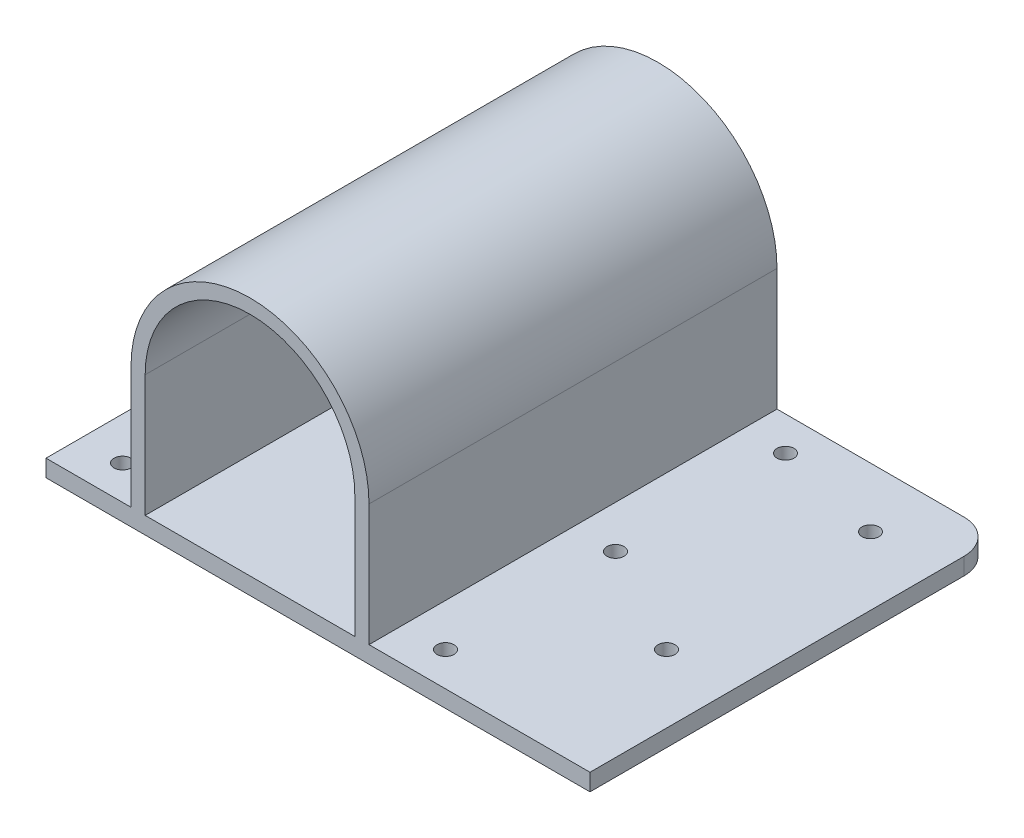
from build123d import *

# Parameters (mm, degrees)
SKETCH1_R           = 1.65
SKETCH1_R_2         = 6.15
BOSS_EXTRUDE1_DEPTH = 72
CUT_EXTRUDE1_DEPTH  = 57
SKETCH3_R           = 1.5
CUT_EXTRUDE2_DEPTH  = 92.028841583
SKETCH4_W           = 24
SKETCH4_H           = 72
SKETCH4_R           = 1.5
BOSS_EXTRUDE2_DEPTH = 3
FILLET1_R           = 6


with BuildPart() as part:
    # Sketch1 → Boss-Extrude1 (new body)
    with BuildSketch(Plane.XY):
        with BuildLine():
            Line((-21, 0), (-21, -21.5))
            Line((-21, -21.5), (-36, -21.5))
            Line((-36, -21.5), (-36, -24.5))
            Line((-36, -24.5), (36, -24.5))
            Line((36, -24.5), (36, -21.5))
            Line((36, -21.5), (21, -21.5))
            Line((21, -21.5), (21, 0))
            ThreePointArc((21, 0), (0, 21), (-21, 0))
        make_face()
        with Locations((0, 15.5)):
            Circle(SKETCH1_R, mode=Mode.SUBTRACT)
        with Locations((13.423393759, 7.75)):
            Circle(SKETCH1_R, mode=Mode.SUBTRACT)
        with Locations((13.423393759, -7.75)):
            Circle(SKETCH1_R, mode=Mode.SUBTRACT)
        with Locations((0, -15.5)):
            Circle(SKETCH1_R, mode=Mode.SUBTRACT)
        with Locations((-13.423393759, -7.75)):
            Circle(SKETCH1_R, mode=Mode.SUBTRACT)
        with Locations((-13.423393759, 7.75)):
            Circle(SKETCH1_R, mode=Mode.SUBTRACT)
        with Locations((7, 0)):
            Circle(SKETCH1_R_2, mode=Mode.SUBTRACT)
    extrude(amount=BOSS_EXTRUDE1_DEPTH)

    # Sketch2 → Cut-Extrude1 (cut)
    with BuildSketch(Plane.XY.offset(72)):
        with BuildLine():
            Line((-18.5, 0), (-18.5, -21.5))
            Line((-18.5, -21.5), (18.5, -21.5))
            Line((18.5, -21.5), (18.5, 0))
            ThreePointArc((18.5, 0), (0, 18.5), (-18.5, 0))
        make_face()
    extrude(amount=-CUT_EXTRUDE1_DEPTH, mode=Mode.SUBTRACT)

    # Sketch3 → Cut-Extrude2 (cut, through all)
    with BuildSketch(Plane(origin=(0, -21.5, 0), x_dir=(1, 0, 0), z_dir=(0, 1, 0))):
        with Locations(Location((-28.5, -36, 0), (0, 0, 270))):
            Circle(SKETCH3_R)
        with Locations(Location((-28.5, -6, 0), (0, 0, 270))):
            Circle(SKETCH3_R)
        with Locations(Location((-28.5, -66, 0), (0, 0, 270))):
            Circle(SKETCH3_R)
        with Locations(Location((28.5, -66, 0), (0, 0, 90))):
            Circle(SKETCH3_R)
        with Locations(Location((28.5, -6, 0), (0, 0, 90))):
            Circle(SKETCH3_R)
        with Locations(Location((28.5, -36, 0), (0, 0, 90))):
            Circle(SKETCH3_R)
    extrude(amount=-CUT_EXTRUDE2_DEPTH, mode=Mode.SUBTRACT)

    # Sketch4 → Boss-Extrude2 (add)
    with BuildSketch(Plane(origin=(0, -21.5, 0), x_dir=(1, 0, 0), z_dir=(0, 1, 0))):
        with Locations((48, -36)):
            Rectangle(SKETCH4_W, SKETCH4_H)
        with Locations(Location((48, -10.5, 0), (0, 0, 270))):
            Circle(SKETCH4_R, mode=Mode.SUBTRACT)
        with Locations(Location((48, -46.5, 0), (0, 0, 270))):
            Circle(SKETCH4_R, mode=Mode.SUBTRACT)
    extrude(amount=-BOSS_EXTRUDE2_DEPTH)

    # Fillet1
    fillet1_edges = [part.edges().sort_by_distance(p)[0] for p in [
        (60, -23, 0),
    ]]
    fillet(fillet1_edges, radius=FILLET1_R)


solid = part.part
